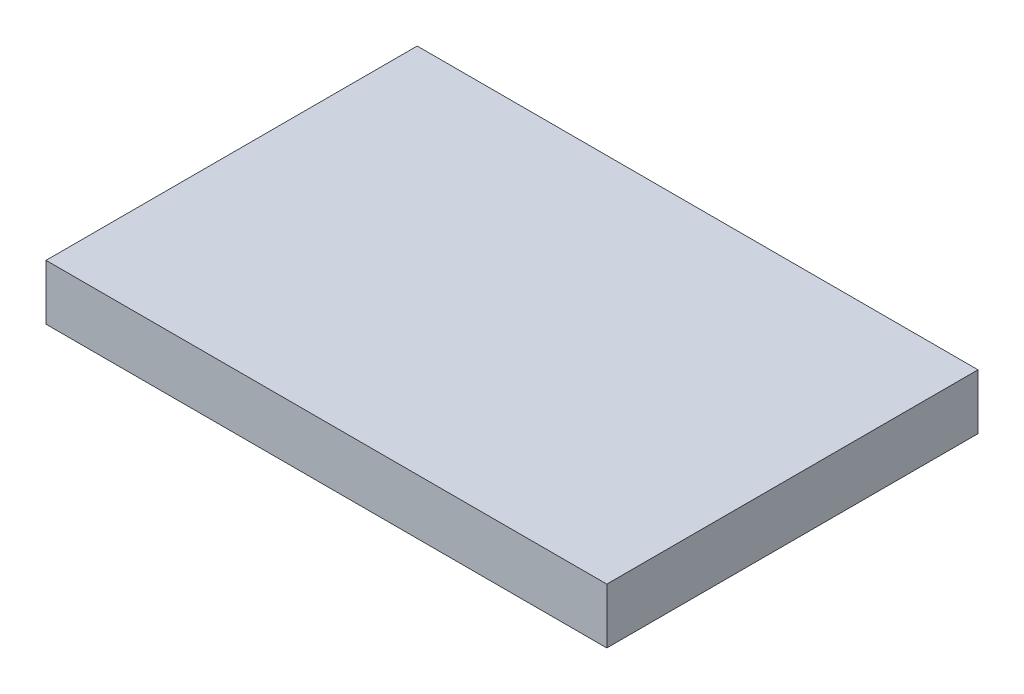
from build123d import *

# Parameters (mm, degrees)
SKETCH_1_W      = 101.360299963
SKETCH_1_H      = 67.091675059
EXTRUDE_1_DEPTH = 10


with BuildPart() as part:
    # 草图1 → 凸台-拉伸1 (new body)
    with BuildSketch(Plane(origin=(0, 0, 0), x_dir=(1, 0, 0), z_dir=(0, 1, 0))):
        with Locations((50.680149982, -33.54583753)):
            Rectangle(SKETCH_1_W, SKETCH_1_H)
    extrude(amount=EXTRUDE_1_DEPTH)


solid = part.part
